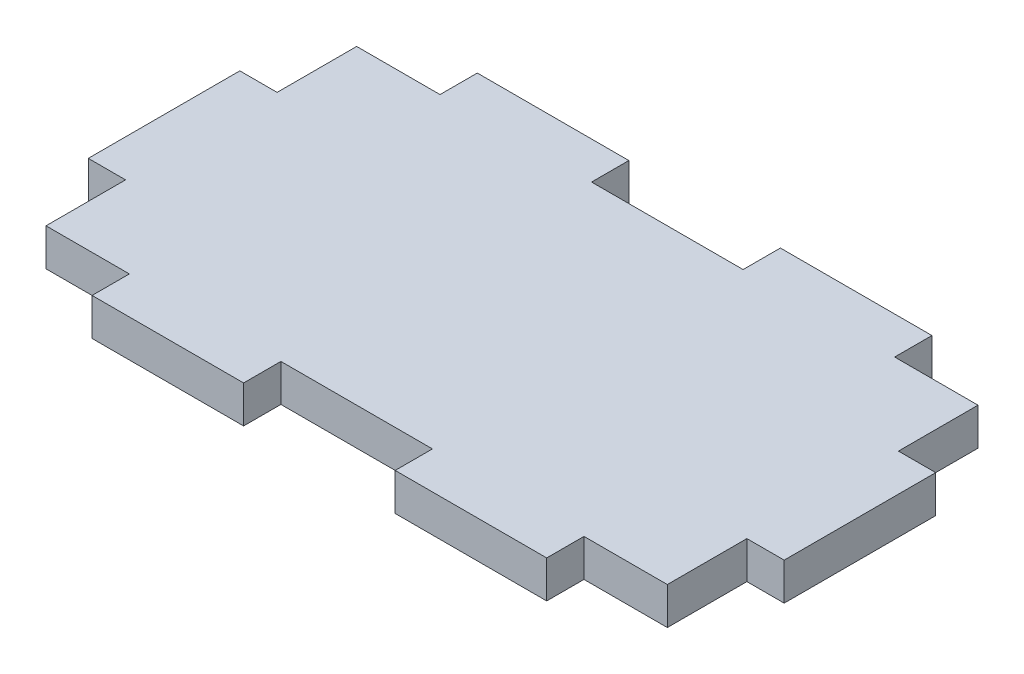
from build123d import *

# Parameters (mm, degrees)
BOSS_EXTRUDE1_DEPTH = 6


with BuildPart() as part:
    # Sketch1 → Boss-Extrude1 (new body)
    with BuildSketch(Plane(origin=(0, 0, 0), x_dir=(1, 0, 0), z_dir=(0, 1, 0))):
        Polygon((186, 59), (186, 46.195), (180, 46.195), (180, 21.805), (186, 21.805), (186, 9), (199.415, 9), (199.415, 3), (223.805, 3), (223.805, 9), (248.195, 9), (248.195, 3), (272.585, 3), (272.585, 9), (286, 9), (286, 21.805), (292, 21.805), (292, 46.195), (286, 46.195), (286, 59), (272.585, 59), (272.585, 65), (248.195, 65), (248.195, 59), (223.805, 59), (223.805, 65), (199.415, 65), (199.415, 59), align=None)
    extrude(amount=BOSS_EXTRUDE1_DEPTH)


solid = part.part
